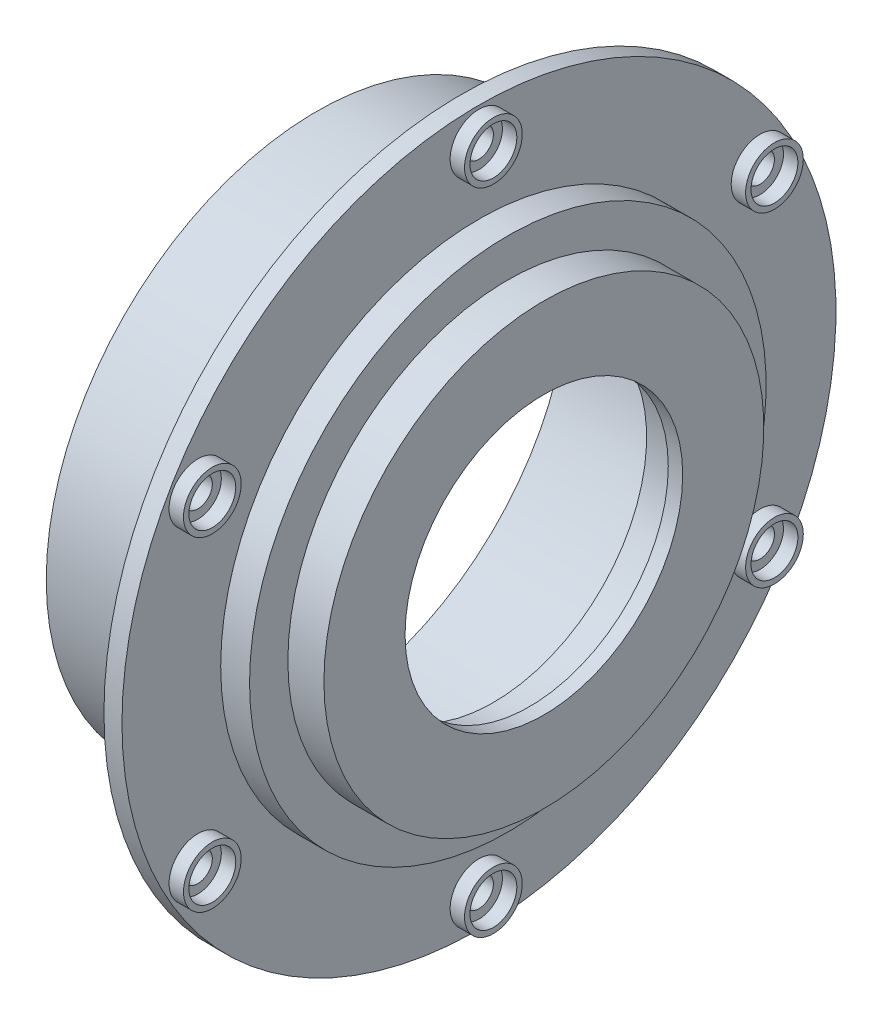
from build123d import *

# Parameters (mm, degrees)
SKETCH3_R           = 4
CUT_EXTRUDE1_DEPTH  = 10
SKETCH4_R           = 8
SKETCH4_R_2         = 6.5
BOSS_EXTRUDE1_DEPTH = 4


with BuildPart() as part:
    # Sketch1 → Revolve1 (revolve)
    with BuildSketch(Plane.XY, mode=Mode.PRIVATE) as revolve1_sk:
        Polygon((0, 0), (39, 0), (39, -9), (49, -9), (49, -27.5), (59, -27.5), (59, -31.5), (63, -31.5), (63, -9), (53, -9), (53, 1.623676176), (45, 1.623676176), (45, 29), (40, 29), (40, 5), (0, 5), align=None)
    revolve(revolve1_sk.sketch.rotate(Axis((0, -70, 0), (1, 0, 0)), 90), axis=Axis((0, -70, 0), (1, 0, 0)))

    # Sketch3 → Cut-Extrude1 (cut)
    with BuildSketch(Plane(origin=(45, 0, 0), x_dir=(0, 0, -1), z_dir=(1, 0, 0))):
        with Locations((0, 20)):
            Circle(SKETCH3_R)
        with Locations((77.942286341, -25)):
            Circle(SKETCH3_R)
        with Locations((77.942286341, -115)):
            Circle(SKETCH3_R)
        with Locations((0, -160)):
            Circle(SKETCH3_R)
        with Locations((-77.942286341, -115)):
            Circle(SKETCH3_R)
        with Locations((-77.942286341, -25)):
            Circle(SKETCH3_R)
    extrude(amount=-CUT_EXTRUDE1_DEPTH, mode=Mode.SUBTRACT)

    # Sketch4 → Boss-Extrude1 (add)
    # profile 1 of 6: a face of its own
    with BuildSketch(Plane(origin=(45, 0, 0), x_dir=(0, 0, -1), z_dir=(1, 0, 0))):
        with Locations(Location((0, 20, 0), (0, 0, 180))):
            Circle(SKETCH4_R)
        with Locations((0, 20)):
            Circle(SKETCH4_R_2, mode=Mode.SUBTRACT)
    # profile 2 of 6: a face of its own
    with BuildSketch(Plane(origin=(45, 0, 0), x_dir=(0, 0, -1), z_dir=(1, 0, 0))):
        with Locations(Location((77.942286341, -25, 0), (0, 0, 180))):
            Circle(SKETCH4_R)
        with Locations((77.942286341, -25)):
            Circle(SKETCH4_R_2, mode=Mode.SUBTRACT)
    # profile 3 of 6: a face of its own
    with BuildSketch(Plane(origin=(45, 0, 0), x_dir=(0, 0, -1), z_dir=(1, 0, 0))):
        with Locations(Location((77.942286341, -115, 0), (0, 0, 180))):
            Circle(SKETCH4_R)
        with Locations((77.942286341, -115)):
            Circle(SKETCH4_R_2, mode=Mode.SUBTRACT)
    # profile 4 of 6: a face of its own
    with BuildSketch(Plane(origin=(45, 0, 0), x_dir=(0, 0, -1), z_dir=(1, 0, 0))):
        with Locations(Location((0, -160, 0), (0, 0, 180))):
            Circle(SKETCH4_R)
        with Locations((0, -160)):
            Circle(SKETCH4_R_2, mode=Mode.SUBTRACT)
    # profile 5 of 6: a face of its own
    with BuildSketch(Plane(origin=(45, 0, 0), x_dir=(0, 0, -1), z_dir=(1, 0, 0))):
        with Locations(Location((-77.942286341, -115, 0), (0, 0, 180))):
            Circle(SKETCH4_R)
        with Locations((-77.942286341, -115)):
            Circle(SKETCH4_R_2, mode=Mode.SUBTRACT)
    # profile 6 of 6: a face of its own
    with BuildSketch(Plane(origin=(45, 0, 0), x_dir=(0, 0, -1), z_dir=(1, 0, 0))):
        with Locations(Location((-77.942286341, -25, 0), (0, 0, 180))):
            Circle(SKETCH4_R)
        with Locations((-77.942286341, -25)):
            Circle(SKETCH4_R_2, mode=Mode.SUBTRACT)
    extrude(amount=BOSS_EXTRUDE1_DEPTH)


solid = part.part
